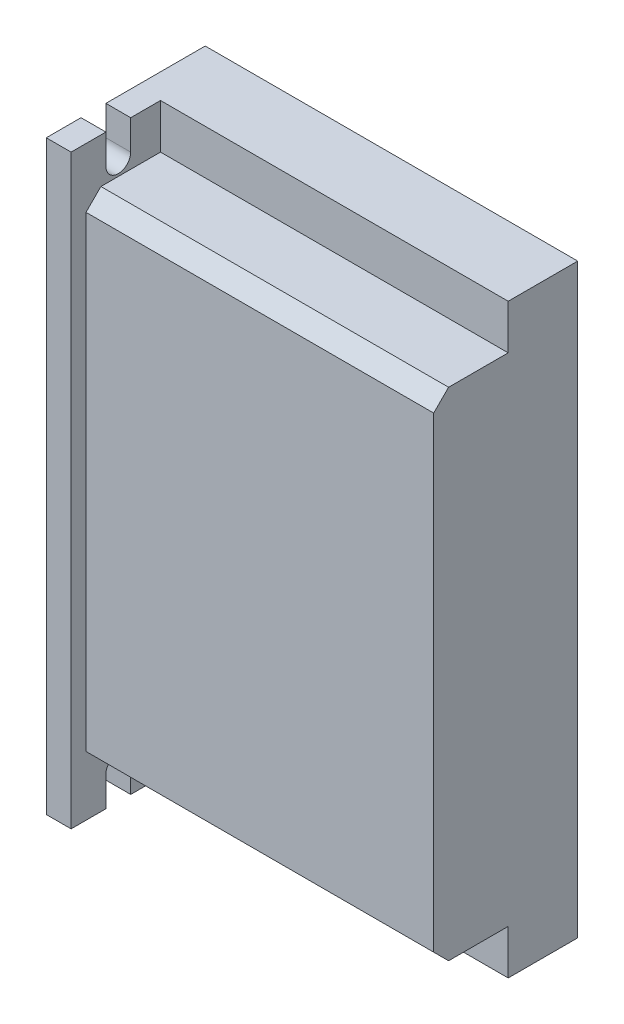
from build123d import *

# Parameters (mm, degrees)
SKETCH_1_W          = 75
SKETCH_1_H          = 100
EXTRUDE_1_DEPTH     = 18
SKETCH_2_W          = 75
SKETCH_2_H          = 118
EXTRUDE_2_DEPTH     = 14
SKETCH_3_W          = 18
SKETCH_3_H          = 118
EXTRUDE_3_DEPTH     = 5
CUT_EXTRUDE_1_DEPTH = 134.529023062
SKETCH_5_W          = 70
SKETCH_5_H          = 100
CUT_EXTRUDE_2_DEPTH = 3
CHAMFER_1_SIZE      = 3


with BuildPart() as part:
    # Эскиз1 → Бобышка-Вытянуть1 (new body)
    with BuildSketch(Plane.XY):
        with Locations((37.5, 50)):
            Rectangle(SKETCH_1_W, SKETCH_1_H)
    extrude(amount=EXTRUDE_1_DEPTH)

    # Эскиз2 → Бобышка-Вытянуть2 (add)
    with BuildSketch(Plane(origin=(0, 0, 0), x_dir=(-1, 0, 0), z_dir=(0, 0, -1))):
        with Locations((-37.5, 50)):
            Rectangle(SKETCH_2_W, SKETCH_2_H)
    extrude(amount=EXTRUDE_2_DEPTH)

    # Эскиз3 → Бобышка-Вытянуть3 (add)
    with BuildSketch(Plane.ZY):
        with Locations((9, 50)):
            Rectangle(SKETCH_3_W, SKETCH_3_H)
    extrude(amount=-EXTRUDE_3_DEPTH)

    # Эскиз4 → Вырез-Вытянуть1 (cut, through all)
    with BuildSketch(Plane.ZY):
        with BuildLine():
            Line((11, 114.734094435), (11, 103))
            ThreePointArc((11, 103), (8.5, 100.5), (6, 103))
            Line((6, 103), (6, 114.734094435))
            ThreePointArc((6, 114.734094435), (8.5, 117.234094435), (11, 114.734094435))
        make_face()
        with BuildLine():
            Line((11, -14.734094435), (11, -3))
            ThreePointArc((11, -3), (8.5, -0.5), (6, -3))
            Line((6, -3), (6, -14.734094435))
            ThreePointArc((6, -14.734094435), (8.5, -17.234094435), (11, -14.734094435))
        make_face()
    extrude(amount=-CUT_EXTRUDE_1_DEPTH, mode=Mode.SUBTRACT)

    # Эскиз5 → Вырез-Вытянуть2 (cut)
    with BuildSketch(Plane.XY.offset(18)):
        with Locations((40, 50)):
            Rectangle(SKETCH_5_W, SKETCH_5_H)
    extrude(amount=-CUT_EXTRUDE_2_DEPTH, mode=Mode.SUBTRACT)

    # Фаска1
    chamfer_1_edges = [part.edges().sort_by_distance(p)[0] for p in [
        (40, 100, 15),
        (40, 0, 15),
    ]]
    chamfer(chamfer_1_edges, length=CHAMFER_1_SIZE)


solid = part.part
